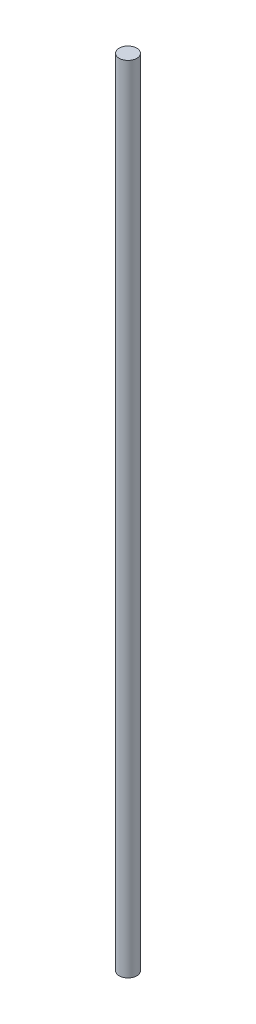
from build123d import *

# Parameters (mm, degrees)
SKETCH_1_R      = 0.1
EXTRUDE_1_DEPTH = 9


with BuildPart() as part:
    # Эскиз1 → Бобышка-Вытянуть1 (new body)
    with BuildSketch(Plane(origin=(0, 0, 0), x_dir=(1, 0, 0), z_dir=(0, 1, 0))):
        with Locations(Location((0, 0, 0), (0, 0, 270))):
            Circle(SKETCH_1_R)
    extrude(amount=EXTRUDE_1_DEPTH)


solid = part.part
